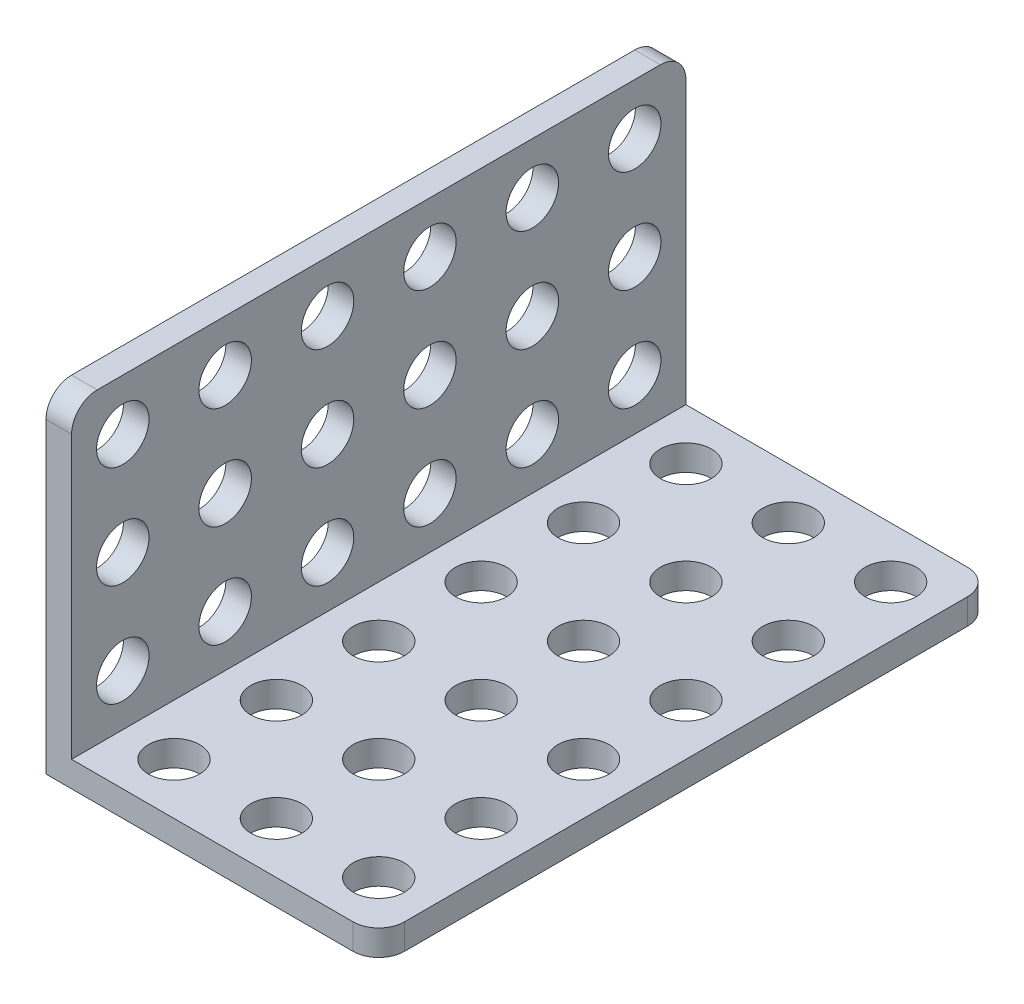
from build123d import *

# Parameters (mm, degrees)
BOSS_EXTRUDE1_DEPTH  = 48
SKETCH2_R            = 2.05
CUT_EXTRUDE1_DEPTH   = 60.632206064
LPATTERN1_COUNT      = 6
LPATTERN1_PITCH      = 8
LPATTERN1_COUNT_DIR2 = 3
LPATTERN1_PITCH_DIR2 = 8
SKETCH3_R            = 2
CUT_EXTRUDE2_DEPTH   = 60.632206064
LPATTERN2_COUNT      = 6
LPATTERN2_PITCH      = 8
LPATTERN2_COUNT_DIR2 = 3
LPATTERN2_PITCH_DIR2 = 8
FILLET1_R            = 2


with BuildPart() as part:
    # Sketch1 → Boss-Extrude1 (new body)
    with BuildSketch(Plane.XY):
        Polygon((0, 0), (0, 26), (2, 26), (2, 2), (26, 2), (26, 0), align=None)
    extrude(amount=BOSS_EXTRUDE1_DEPTH)

    # Sketch2 → Cut-Extrude1 (cut, through all)
    with BuildSketch(Plane(origin=(2, 0, 0), x_dir=(0, 0, -1), z_dir=(1, 0, 0))):
        with Locations(Location((-44, 22, 0), (0, 0, 90))):
            Circle(SKETCH2_R)
    cut_extrude1 = extrude(amount=-CUT_EXTRUDE1_DEPTH, mode=Mode.SUBTRACT)

    # LPattern1: Cut-Extrude1 6 × 3
    with Locations(*[(0, -j * LPATTERN1_PITCH_DIR2, -i * LPATTERN1_PITCH) for i in range(LPATTERN1_COUNT) for j in range(LPATTERN1_COUNT_DIR2) if (i, j) != (0, 0)]):
        add(cut_extrude1, mode=Mode.SUBTRACT)

    # Sketch3 → Cut-Extrude2 (cut, through all)
    with BuildSketch(Plane(origin=(0, 2, 0), x_dir=(1, 0, 0), z_dir=(0, 1, 0))):
        with Locations(Location((22, -4, 0), (0, 0, 270))):
            Circle(SKETCH3_R)
    cut_extrude2 = extrude(amount=-CUT_EXTRUDE2_DEPTH, mode=Mode.SUBTRACT)

    # LPattern2: Cut-Extrude2 6 × 3
    with Locations(*[(-j * LPATTERN2_PITCH_DIR2, 0, i * LPATTERN2_PITCH) for i in range(LPATTERN2_COUNT) for j in range(LPATTERN2_COUNT_DIR2) if (i, j) != (0, 0)]):
        add(cut_extrude2, mode=Mode.SUBTRACT)

    # Fillet1
    fillet1_edges = [part.edges().sort_by_distance(p)[0] for p in [
        (1, 26, 48),
        (1, 26, 0),
        (26, 1, 48),
        (26, 1, 0),
    ]]
    fillet(fillet1_edges, radius=FILLET1_R)


solid = part.part
